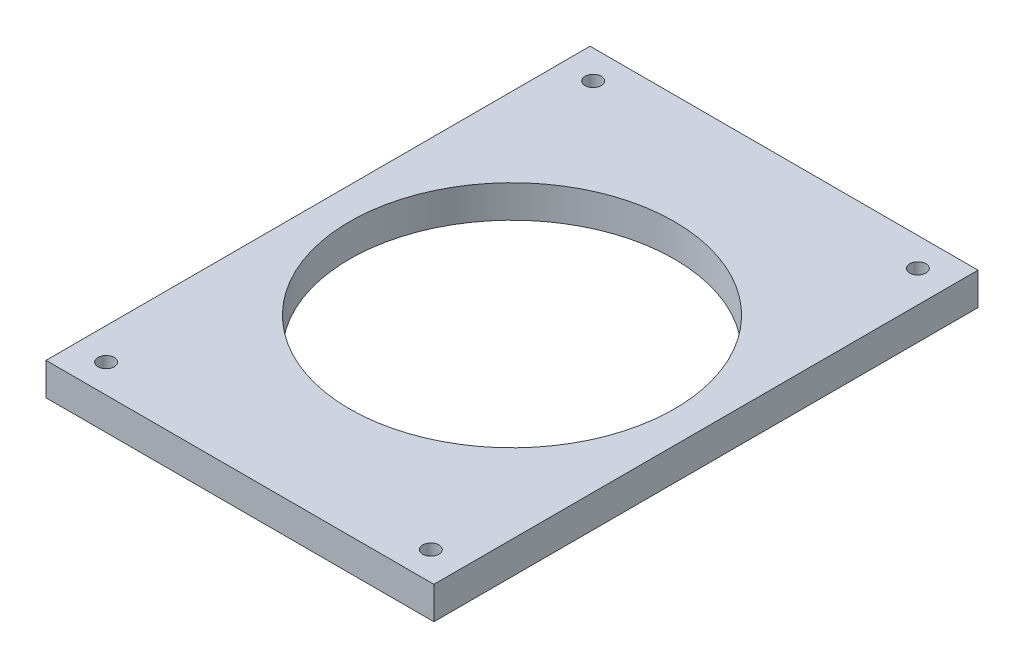
from build123d import *

# Parameters (mm, degrees)
SKETCH1_W           = 119.469704638
SKETCH1_H           = 167.573018056
SKETCH1_R           = 50
SKETCH1_R_2         = 2.5
BOSS_EXTRUDE1_DEPTH = 10


with BuildPart() as part:
    # Sketch1 → Boss-Extrude1 (new body)
    with BuildSketch(Plane(origin=(0, 0, 0), x_dir=(1, 0, 0), z_dir=(0, 1, 0))):
        Rectangle(SKETCH1_W, SKETCH1_H)
        with Locations(Location((0, 0, 0), (0, 0, 270))):
            Circle(SKETCH1_R, mode=Mode.SUBTRACT)
        with Locations(Location((50, 75, 0), (0, 0, 270))):
            Circle(SKETCH1_R_2, mode=Mode.SUBTRACT)
        with Locations(Location((-50, 75, 0), (0, 0, 270))):
            Circle(SKETCH1_R_2, mode=Mode.SUBTRACT)
        with Locations(Location((-50, -75, 0), (0, 0, 270))):
            Circle(SKETCH1_R_2, mode=Mode.SUBTRACT)
        with Locations(Location((50, -75, 0), (0, 0, 270))):
            Circle(SKETCH1_R_2, mode=Mode.SUBTRACT)
    extrude(amount=BOSS_EXTRUDE1_DEPTH)


solid = part.part
